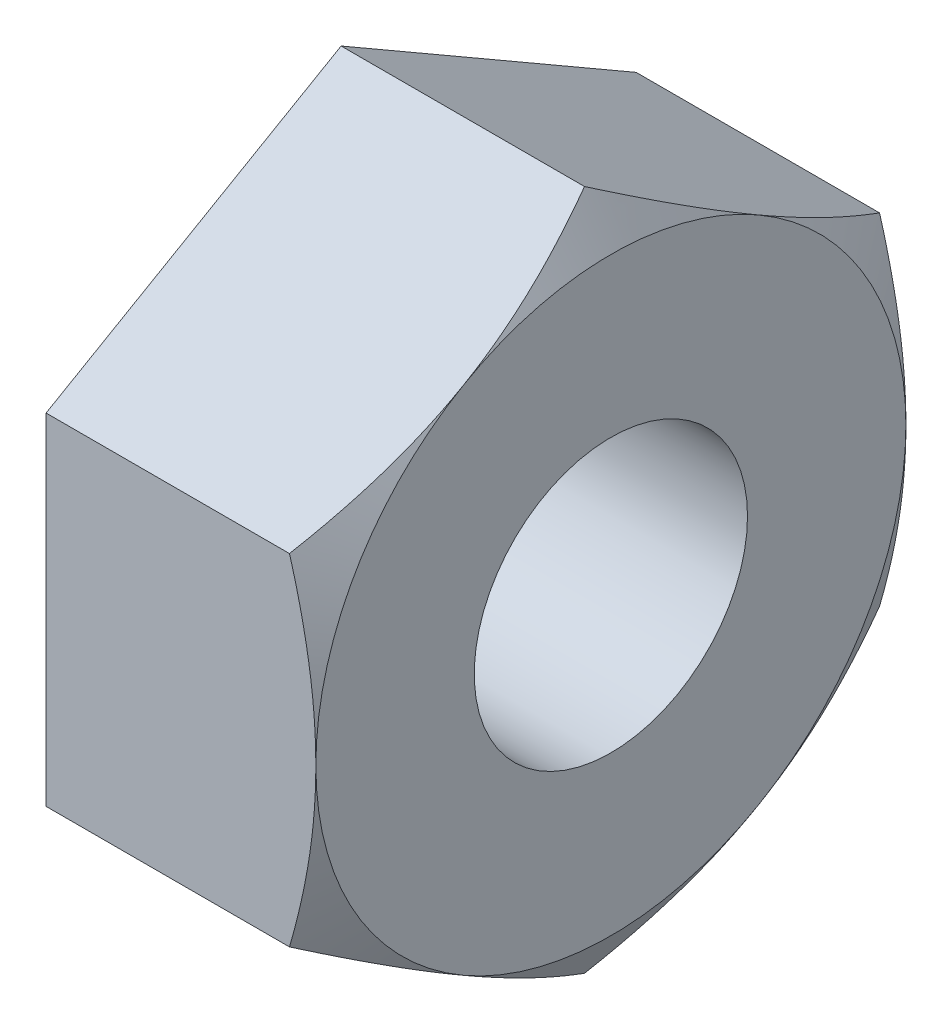
from build123d import *

# Parameters (mm, degrees)
BOSS_EXTRUDE1_DEPTH = 3.2
TAP1_D              = 3.242


with BuildPart() as part:
    # Sketch1 → Boss-Extrude1 (new body)
    with BuildSketch(Plane(origin=(0, 0, 0), x_dir=(0, 0, -1), z_dir=(1, 0, 0))):
        Polygon((0, 4.041451884), (-3.5, 2.020725942), (-3.5, -2.020725942), (0, -4.041451884), (3.5, -2.020725942), (3.5, 2.020725942), align=None)
    extrude(amount=-BOSS_EXTRUDE1_DEPTH)

    # Sketch2 → Cut-Revolve1 (revolve, cut)
    with BuildSketch(Plane.XY):
        Polygon((0, 3.5), (-0.312607391, 4.041451884), (0, 4.041451884), align=None)
    revolve(axis=Axis((-0.312607391, 0, 0), (1, 0, 0)), mode=Mode.SUBTRACT)

    # Tap1 (through all)
    with Locations(Plane(origin=(0, 0, 0), x_dir=(0, 0, -1), z_dir=(1, 0, 0))):
        with Locations((0, 0)):
            Hole(TAP1_D / 2)


solid = part.part
